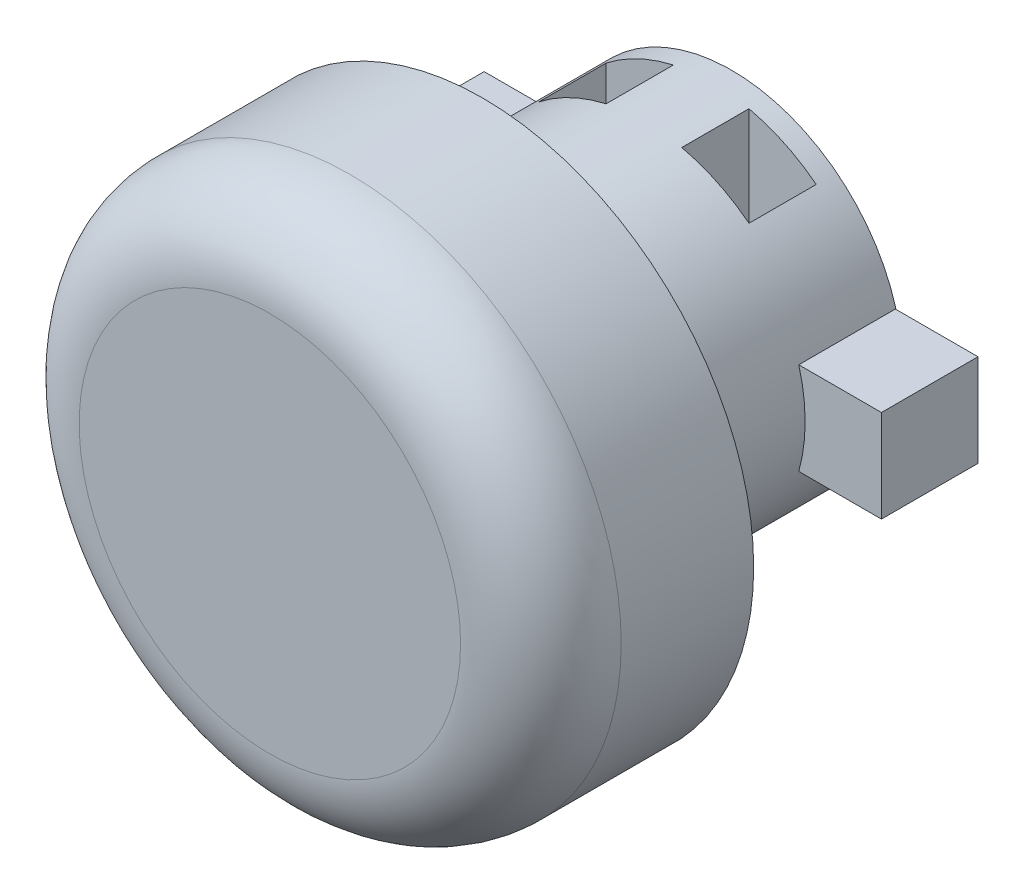
from build123d import *

# Parameters (mm, degrees)
SKETCH1_R               = 42.5
BOSS_EXTRUDE1_DEPTH     = 76
SKETCH2_R               = 67.5
BOSS_EXTRUDE2_DEPTH     = 39
FILLET1_R               = 20
BOSS_EXTRUDE3_START     = 14
SKETCH3_R               = 67.5
SKETCH3_R_2             = 62.5
BOSS_EXTRUDE3_DEPTH     = 14
SKETCH4_W               = 123
SKETCH4_H               = 24.049182643
BOSS_EXTRUDE4_DEPTH     = 11.5
CUT_EXTRUDE1_DEPTH      = 150.457351776
CUT_EXTRUDE1_DEPTH_BACK = 150.457351776
SKETCH5_W               = 16.750654132
SKETCH5_H               = 16.750654132


with BuildPart() as part:
    # Sketch1 → Boss-Extrude1 (new body)
    with BuildSketch(Plane.XY):
        Circle(SKETCH1_R)
    extrude(amount=BOSS_EXTRUDE1_DEPTH)

    # Sketch2 → Boss-Extrude2 (add)
    with BuildSketch(Plane.XY.offset(76)):
        Circle(SKETCH2_R)
    extrude(amount=BOSS_EXTRUDE2_DEPTH)

    # Fillet1
    fillet1_edges = [part.edges().sort_by_distance(p)[0] for p in [
        (-67.5, 0, 115),
    ]]
    fillet(fillet1_edges, radius=FILLET1_R)

    # Sketch3 → Boss-Extrude3 (add)
    with BuildSketch(Plane(origin=(0, 0, 76), x_dir=(-1, 0, 0), z_dir=(0, 0, -1)).offset(BOSS_EXTRUDE3_START)):
        Circle(SKETCH3_R)
        Circle(SKETCH3_R_2, mode=Mode.SUBTRACT)
    extrude(amount=-BOSS_EXTRUDE3_DEPTH)

    # Sketch4 → Boss-Extrude4 (add, symmetric)
    with BuildSketch(Plane(origin=(0, 0, 0), x_dir=(1, 0, 0), z_dir=(0, 1, 0))):
        with Locations((0, -12.155455807)):
            Rectangle(SKETCH4_W, SKETCH4_H)
    extrude(amount=BOSS_EXTRUDE4_DEPTH, both=True)

    # Sketch5 → Cut-Extrude1 (cut, two sides: drawn at the far end of the back side and taken through both)
    with BuildSketch(Plane(origin=(0, 0, 0), x_dir=(1, 0, 0), z_dir=(0, 1, 0)).offset(-CUT_EXTRUDE1_DEPTH_BACK)):
        with Locations((-17.797570015, -13.464100661)):
            Rectangle(SKETCH5_W, SKETCH5_H)
        with Locations((17.797570015, -13.464100661)):
            Rectangle(SKETCH5_W, SKETCH5_H)
    extrude(amount=CUT_EXTRUDE1_DEPTH + CUT_EXTRUDE1_DEPTH_BACK, mode=Mode.SUBTRACT)


solid = part.part
